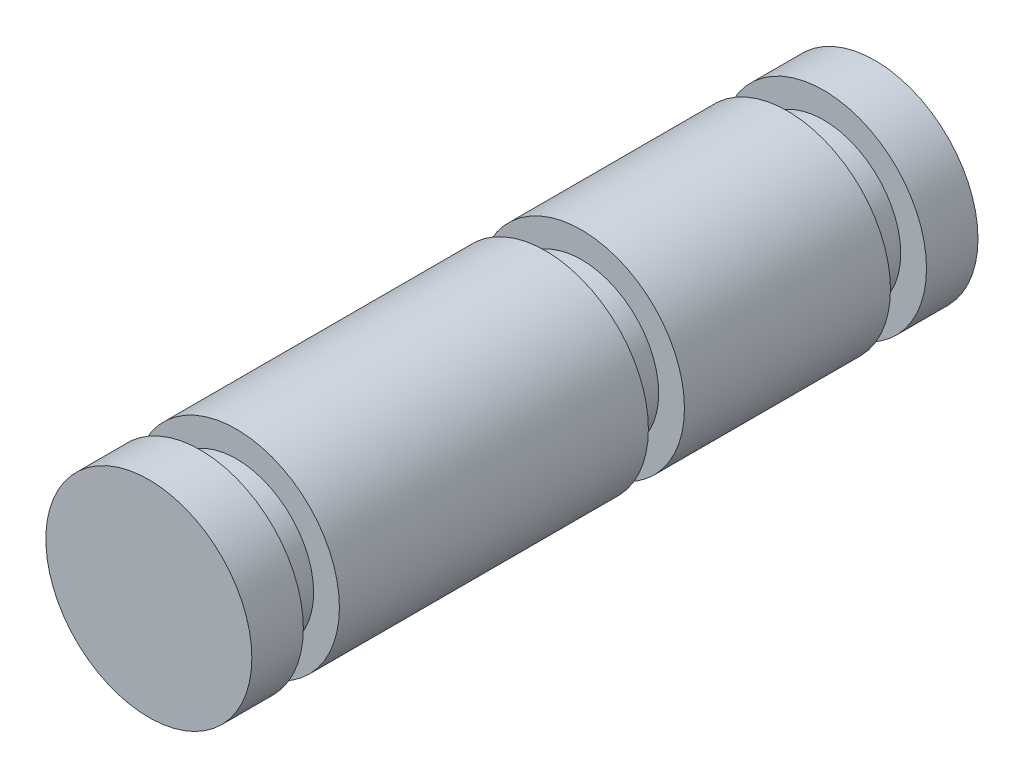
from build123d import *

# Parameters (mm, degrees)
ESBO_O1_R                = 2
RESSALTO_EXTRUS_O1_DEPTH = 1
ESBO_O2_R                = 1.5
RESSALTO_EXTRUS_O2_DEPTH = 0.7
ESBO_O3_R                = 2
RESSALTO_EXTRUS_O3_DEPTH = 4
ESBO_O4_R                = 1.5
RESSALTO_EXTRUS_O4_DEPTH = 0.7
ESBO_O5_R                = 2
RESSALTO_EXTRUS_O5_DEPTH = 6
ESBO_O6_R                = 1.5
RESSALTO_EXTRUS_O6_DEPTH = 0.7
ESBO_O7_R                = 2
RESSALTO_EXTRUS_O7_DEPTH = 1


with BuildPart() as part:
    # Esboço1 → Ressalto-extrusão1 (new body)
    with BuildSketch(Plane.XY):
        Circle(ESBO_O1_R)
    extrude(amount=RESSALTO_EXTRUS_O1_DEPTH)

    # Esboço2 → Ressalto-extrusão2 (add)
    with BuildSketch(Plane.XY.offset(1)):
        Circle(ESBO_O2_R)
    extrude(amount=RESSALTO_EXTRUS_O2_DEPTH)

    # Esboço3 → Ressalto-extrusão3 (add)
    with BuildSketch(Plane.XY.offset(1.7)):
        Circle(ESBO_O3_R)
    extrude(amount=RESSALTO_EXTRUS_O3_DEPTH)

    # Esboço4 → Ressalto-extrusão4 (add)
    with BuildSketch(Plane.XY.offset(5.7)):
        Circle(ESBO_O4_R)
    extrude(amount=RESSALTO_EXTRUS_O4_DEPTH)

    # Esboço5 → Ressalto-extrusão5 (add)
    with BuildSketch(Plane.XY.offset(6.4)):
        Circle(ESBO_O5_R)
    extrude(amount=RESSALTO_EXTRUS_O5_DEPTH)

    # Esboço6 → Ressalto-extrusão6 (add)
    with BuildSketch(Plane.XY.offset(12.4)):
        Circle(ESBO_O6_R)
    extrude(amount=RESSALTO_EXTRUS_O6_DEPTH)

    # Esboço7 → Ressalto-extrusão7 (add)
    with BuildSketch(Plane.XY.offset(13.1)):
        Circle(ESBO_O7_R)
    extrude(amount=RESSALTO_EXTRUS_O7_DEPTH)


solid = part.part
